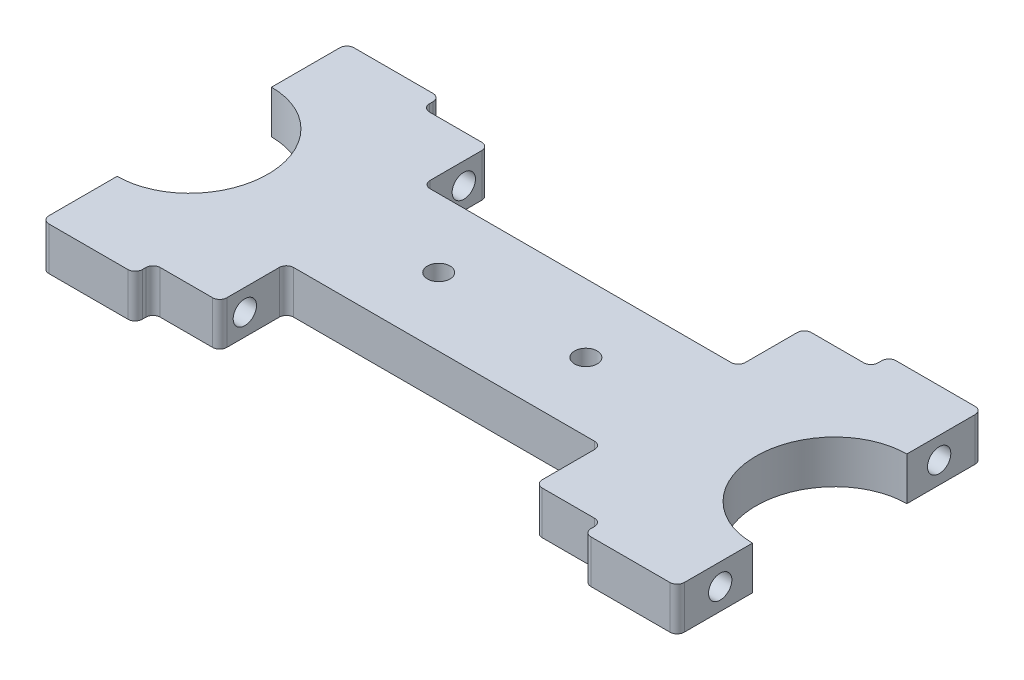
from build123d import *

# Parameters (mm, degrees)
EXTRUDE_1_DEPTH     = 12
SKETCH_2_R          = 3.25
CUT_EXTRUDE_3_DEPTH = 197.754705478
FILLET_1_R          = 2
FILLET_2_R          = 2
SKETCH_3_R          = 3.15
CUT_EXTRUDE_4_DEPTH = 198.654785239


with BuildPart() as part:
    # 草圖1 → 填料-伸長1 (new body)
    with BuildSketch(Plane(origin=(0, 0, 0), x_dir=(1, 0, 0), z_dir=(0, 1, 0))):
        with BuildLine():
            Line((133.424419381, -23.5), (45.575580619, -23.5))
            Line((45.575580619, -23.5), (45.575580619, -5.084746417))
            Line((45.575580619, -5.084746417), (27, -5.084746417))
            Line((27, -5.084746417), (27, -0.084746417))
            Line((27, -0.084746417), (1, -0.084746417))
            Line((1, -0.084746417), (1, -21.084746417))
            add(Edge.make_bspline(
                [(1, -64.084746417), (21.5, -64.084746417), (21.5, -42.584746417), (21.5, -21.084746417), (1, -21.084746417)],
                knots=[3.141592654, 3.141592654, 3.141592654, 4.71238898, 4.71238898, 6.283185307, 6.283185307, 6.283185307], degree=2, weights=[1, 0.707106781, 1, 0.707106781, 1]))
            Line((1, -64.084746417), (1, -85.084746417))
            Line((1, -85.084746417), (27, -85.084746417))
            Line((27, -85.084746417), (27, -80.084746417))
            Line((27, -80.084746417), (45.575580619, -80.084746417))
            Line((45.575580619, -80.084746417), (45.575580619, -61.5))
            Line((45.575580619, -61.5), (133.424419381, -61.5))
            Line((133.424419381, -61.5), (133.424419381, -80.084746417))
            Line((133.424419381, -80.084746417), (152, -80.084746417))
            Line((152, -80.084746417), (152, -85.084746417))
            Line((152, -85.084746417), (178, -85.084746417))
            Line((178, -85.084746417), (178, -64.084746417))
            add(Edge.make_bspline(
                [(178, -21.084746417), (157.5, -21.084746417), (157.5, -42.584746417), (157.5, -64.084746417), (178, -64.084746417)],
                knots=[0, 0, 0, 1.570796327, 1.570796327, 3.141592654, 3.141592654, 3.141592654], degree=2, weights=[1, 0.707106781, 1, 0.707106781, 1]))
            Line((178, -21.084746417), (178, -0.084746417))
            Line((178, -0.084746417), (152, -0.084746417))
            Line((152, -0.084746417), (152, -5.084746417))
            Line((152, -5.084746417), (133.424419381, -5.084746417))
            Line((133.424419381, -5.084746417), (133.424419381, -23.5))
        make_face()
    extrude(amount=EXTRUDE_1_DEPTH)

    # 草圖2 → 除料-伸長3 (cut, through all)
    with BuildSketch(Plane(origin=(178, 0, 0), x_dir=(0, 0, -1), z_dir=(1, 0, 0))):
        with Locations((-12.084746417, 6)):
            Circle(SKETCH_2_R)
        with Locations((-73.084746417, 6)):
            Circle(SKETCH_2_R)
    extrude(amount=-CUT_EXTRUDE_3_DEPTH, mode=Mode.SUBTRACT)

    # 圓角1
    fillet_1_edges = [part.edges().sort_by_distance(p)[0] for p in [
        (45.575580619, 6, 23.5),
        (133.424419381, 6, 23.5),
        (133.424419381, 6, 5.084746417),
        (152, 6, 5.084746417),
        (152, 6, 0.084746417),
        (152, 6, 85.084746417),
        (152, 6, 80.084746417),
        (133.424419381, 6, 80.084746417),
        (133.424419381, 6, 61.5),
        (45.575580619, 6, 61.5),
        (45.575580619, 6, 80.084746417),
        (27, 6, 80.084746417),
        (27, 6, 85.084746417),
        (27, 6, 0.084746417),
        (27, 6, 5.084746417),
        (45.575580619, 6, 5.084746417),
    ]]
    fillet(fillet_1_edges, radius=FILLET_1_R)

    # 圓角2
    fillet_2_edges = [part.edges().sort_by_distance(p)[0] for p in [
        (178, 6, 0.084746417),
        (178, 6, 85.084746417),
        (1, 6, 85.084746417),
        (1, 6, 0.084746417),
    ]]
    fillet(fillet_2_edges, radius=FILLET_2_R)

    # 草圖3 → 除料-伸長4 (cut, through all)
    with BuildSketch(Plane(origin=(0, 12, 0), x_dir=(1, 0, 0), z_dir=(0, 1, 0))):
        with Locations(Location((110, -42.5, 0), (0, 0, 270))):
            Circle(SKETCH_3_R)
        with Locations(Location((69, -42.5, 0), (0, 0, 90))):
            Circle(SKETCH_3_R)
    extrude(amount=-CUT_EXTRUDE_4_DEPTH, mode=Mode.SUBTRACT)


solid = part.part
